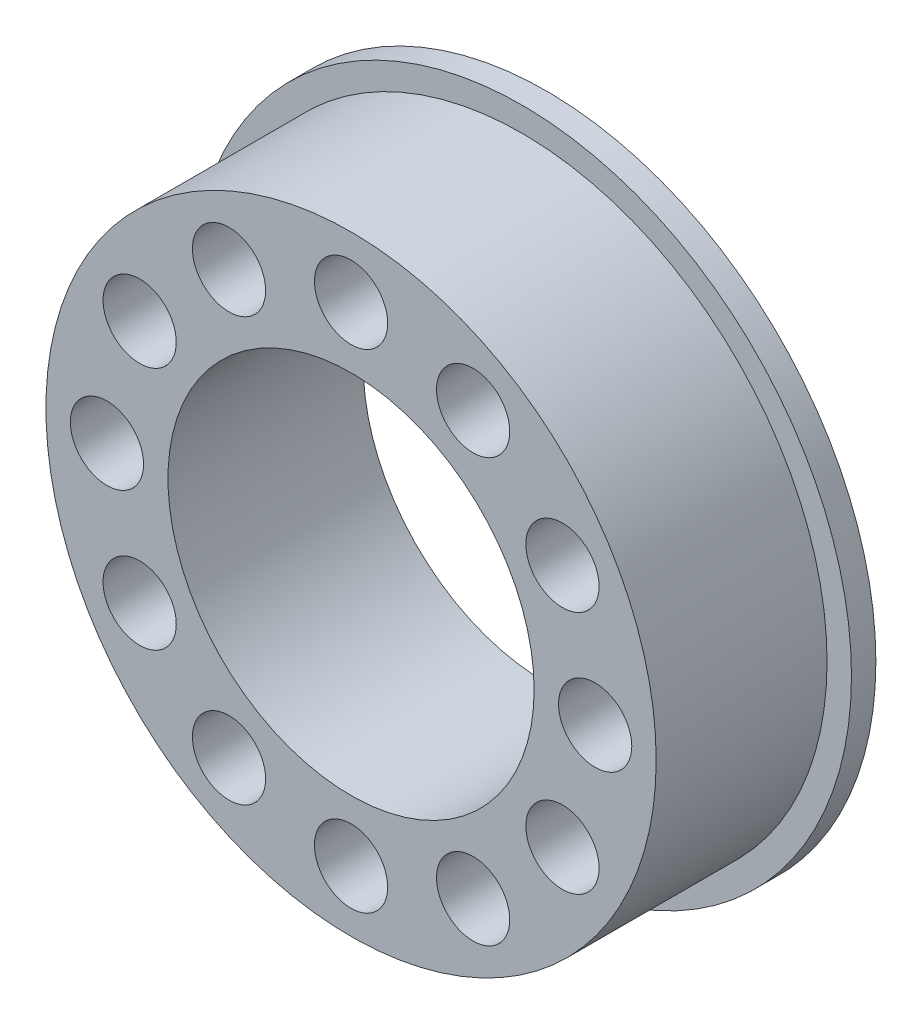
from build123d import *

# Parameters (mm, degrees)
SKETCH_2_R          = 1.5
CUT_EXTRUDE_1_DEPTH = 21.700241544


with BuildPart() as part:
    # ｽｹｯﾁ1 → 回転1 (revolve)
    with BuildSketch(Plane(origin=(0, 0, 0), x_dir=(0, 0, -1), z_dir=(1, 0, 0)), mode=Mode.PRIVATE) as revolve_1_sk:
        Polygon((0, 7.5), (8, 7.5), (8, 13.5), (7, 13.5), (7, 12.5), (0, 12.5), align=None)
    revolve(revolve_1_sk.sketch.rotate(Axis((0, 0, 0), (0, 0, -1)), 90), axis=Axis((0, 0, 0), (0, 0, -1)))

    # ｽｹｯﾁ2 → ｶｯﾄ - 押し出し1 (cut, through all)
    with BuildSketch(Plane.XY):
        with Locations((0, 10)):
            Circle(SKETCH_2_R)
        with Locations((5, 8.660254038)):
            Circle(SKETCH_2_R)
        with Locations((8.660254038, 5)):
            Circle(SKETCH_2_R)
        with Locations((10, 0)):
            Circle(SKETCH_2_R)
        with Locations((8.660254038, -5)):
            Circle(SKETCH_2_R)
        with Locations((5, -8.660254038)):
            Circle(SKETCH_2_R)
        with Locations((0, -10)):
            Circle(SKETCH_2_R)
        with Locations((-5, -8.660254038)):
            Circle(SKETCH_2_R)
        with Locations((-8.660254038, -5)):
            Circle(SKETCH_2_R)
        with Locations((-10, 0)):
            Circle(SKETCH_2_R)
        with Locations((-8.660254038, 5)):
            Circle(SKETCH_2_R)
        with Locations((-5, 8.660254038)):
            Circle(SKETCH_2_R)
    extrude(amount=-CUT_EXTRUDE_1_DEPTH, mode=Mode.SUBTRACT)


solid = part.part
